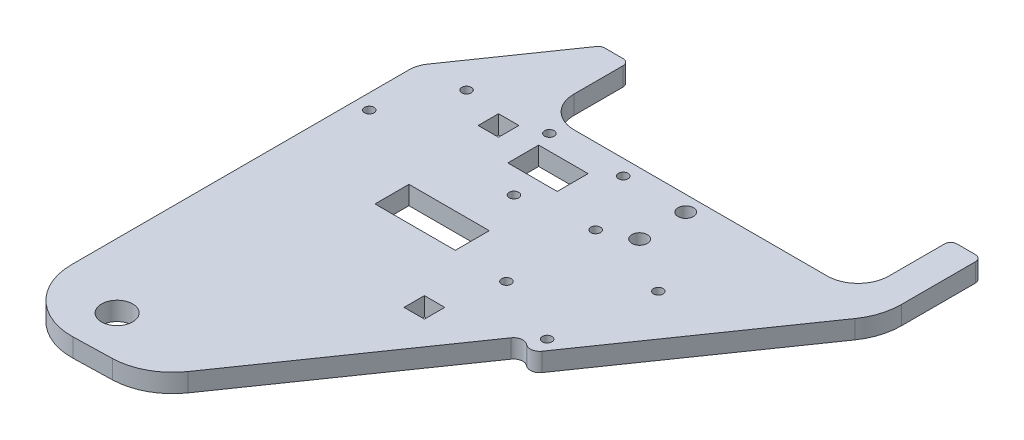
from build123d import *

# Parameters (mm, degrees)
DODANIE_WYCI_GNI_CIE1_DEPTH = 6
SZKIC3_R                    = 5.05
WYTNIJ_WYCI_GNI_CIE1_DEPTH  = 172.237795034
SZKIC5_R                    = 1.55
SZKIC5_W                    = 26
SZKIC5_H                    = 11
SZKIC5_W_2                  = 16
SZKIC5_H_2                  = 10
WYTNIJ_WYCI_GNI_CIE2_DEPTH  = 172.237795034
DODANIE_WYCI_GNI_CIE2_DEPTH = 6
SZKIC6_R                    = 1.55
WYTNIJ_WYCI_GNI_CIE3_DEPTH  = 172.237795034
DODANIE_WYCI_GNI_CIE3_DEPTH = 6
SZKIC9_R                    = 1.55
WYTNIJ_WYCI_GNI_CIE5_DEPTH  = 6
SZKIC11_R                   = 1.55
WYTNIJ_WYCI_GNI_CIE6_DEPTH  = 6
SZKIC15_R                   = 2.5
WYTNIJ_WYCI_GNI_CIE7_DEPTH  = 6
SZKIC8_R                    = 1.55
WYTNIJ_WYCI_GNI_CIE4_DEPTH  = 172.237795034
SZKIC20_W                   = 6.6
SZKIC20_H                   = 6.6
WYTNIJ_WYCI_GNI_CIE9_DEPTH  = 6
WYTNIJ_WYCI_GNI_CIE10_DEPTH = 10


with BuildPart() as part:
    # Szkic2 → Dodanie-wyciągnięcie1 (new body)
    with BuildSketch(Plane(origin=(0, 0, 0), x_dir=(1, 0, 0), z_dir=(0, 1, 0))):
        with BuildLine():
            Line((-2.705874152, 127.916025414), (-8.705874152, 127.916025414))
            ThreePointArc((-8.705874152, 127.916025414), (-10.120087715, 127.330238976), (-10.705874152, 125.916025414))
            Line((-10.705874152, 125.916025414), (-10.705874152, 88.696086508))
            ThreePointArc((-10.705874152, 88.696086508), (-11.877447027, 85.867659383), (-14.705874152, 84.696086508))
            Line((-14.705874152, 84.696086508), (-30.205874152, 84.696086508))
            ThreePointArc((-30.205874152, 84.696086508), (-33.034301277, 83.524513632), (-34.205874152, 80.696086508))
            Line((-34.205874152, 80.696086508), (-34.205874152, 69.929357434))
            Line((-34.205874152, 69.929357434), (-34.205874152, 68.036244156))
            Line((-34.205874152, 68.036244156), (-34.205874152, 10.604511111))
            Line((-34.205874152, 10.604511111), (-34.205874152, -19.154356935))
            ThreePointArc((-34.205874152, -19.154356935), (-21.880415638, -37.623287954), (-0.095732854, -33.328414665))
            Line((-0.095732854, -33.328414665), (14.157093559, -19.139859884))
            Line((14.157093559, -19.139859884), (55.027168237, 21.545915465))
            ThreePointArc((55.027168237, 21.545915465), (56.334805154, 23.495770338), (56.794125848, 25.798132784))
            Line((56.794125848, 25.798132784), (56.794125848, 30.935818421))
            Line((56.794125848, 30.935818421), (56.794125848, 59.333926751))
            ThreePointArc((56.794125848, 59.333926751), (64.677605901, 81.048439594), (85.935948442, 90.090131813))
            Line((85.935948442, 90.090131813), (91.371133341, 90.090131813))
            ThreePointArc((91.371133341, 90.090131813), (105.458816444, 95.925441216), (111.294125848, 110.013124319))
            Line((111.294125848, 110.013124319), (111.294125848, 128))
            ThreePointArc((111.294125848, 128), (110.70833941, 129.414213562), (109.294125848, 130))
            Line((109.294125848, 130), (103.294125848, 130))
            ThreePointArc((103.294125848, 130), (101.879912285, 129.414213562), (101.294125848, 128))
            Line((101.294125848, 128), (101.294125848, 110))
            ThreePointArc((101.294125848, 110), (98.36519366, 102.928932188), (91.294125848, 100))
            Line((91.294125848, 100), (9.294125848, 100))
            ThreePointArc((9.294125848, 100), (2.223058036, 102.928932188), (-0.705874152, 110))
            Line((-0.705874152, 110), (-0.705874152, 125.916025414))
            ThreePointArc((-0.705874152, 125.916025414), (-1.29166059, 127.330238976), (-2.705874152, 127.916025414))
        make_face()
    extrude(amount=DODANIE_WYCI_GNI_CIE1_DEPTH)

    # Szkic3 → Wytnij-wyciągnięcie1 (cut, through all)
    with BuildSketch(Plane(origin=(0, 6, 0), x_dir=(1, 0, 0), z_dir=(0, 1, 0))):
        with Locations(Location((-13.29618586, -25.303913492, 0), (0, 0, 270))):
            Circle(SZKIC3_R)
    extrude(amount=-WYTNIJ_WYCI_GNI_CIE1_DEPTH, mode=Mode.SUBTRACT)

    # Szkic5 → Wytnij-wyciągnięcie2 (cut, through all)
    with BuildSketch(Plane(origin=(0, 6, 0), x_dir=(1, 0, 0), z_dir=(0, 1, 0))):
        with Locations(Location((40.894125848, 75.45, 0), (0, 0, 270))):
            Circle(SZKIC5_R)
        with Locations(Location((30.260526652, 95, 0), (0, 0, 270))):
            Circle(SZKIC5_R)
        with Locations(Location((6.360542819, 95, 0), (0, 0, 270))):
            Circle(SZKIC5_R)
        with Locations(Location((40.894125848, 46.55, 0), (0, 0, 270))):
            Circle(SZKIC5_R)
        with Locations(Location((17.894125848, 72, 0), (0, 0, 270))):
            Circle(SZKIC5_R)
        with Locations((10.894125848, 52.5)):
            Rectangle(SZKIC5_W, SZKIC5_H)
        with Locations((15.894125848, 85)):
            Rectangle(SZKIC5_W_2, SZKIC5_H_2)
    extrude(amount=-WYTNIJ_WYCI_GNI_CIE2_DEPTH, mode=Mode.SUBTRACT)

    # Szkic12 → Dodanie-wyciągnięcie2 (add)
    with BuildSketch(Plane.XZ):
        with BuildLine():
            Line((28.406352316, 21.766792401), (22.674893132, 30.029606522))
            ThreePointArc((22.674893132, 30.029606522), (15.741620567, 36.230120828), (6.753517107, 38.623996834))
            Line((6.753517107, 38.623996834), (-1.505533921, 38.835570804))
            Line((-1.505533921, 38.835570804), (-13.693695858, 39.147797694))
            Line((-13.693695858, 39.147797694), (55.027168237, -21.545915465))
            ThreePointArc((55.027168237, -21.545915465), (56.334805154, -23.495770338), (56.794125848, -25.798132784))
            Line((56.794125848, -25.798132784), (56.794125848, -59.333926751))
            ThreePointArc((56.794125848, -59.333926751), (64.677605901, -81.048439594), (85.935948442, -90.090131813))
            Line((85.935948442, -90.090131813), (91.371133341, -90.090131813))
            Line((91.371133341, -90.090131813), (111.294125848, -110.013124319))
            Line((111.294125848, -110.013124319), (111.294125848, -103.986622655))
            ThreePointArc((111.294125848, -103.986622655), (110.381700995, -98.014648527), (107.72767835, -92.58757216))
            Line((107.72767835, -92.58757216), (89.166132072, -65.828137643))
            Line((89.166132072, -65.828137643), (62.775344571, -27.781601032))
            Line((62.775344571, -27.781601032), (28.406352316, 21.766792401))
        make_face()
    extrude(amount=-DODANIE_WYCI_GNI_CIE2_DEPTH)

    # Szkic6 → Wytnij-wyciągnięcie3 (cut, through all)
    with BuildSketch(Plane.XZ):
        with Locations(Location((68.241593591, -68.382704099, 0), (0, 0, 270))):
            Circle(SZKIC6_R)
    extrude(amount=-WYTNIJ_WYCI_GNI_CIE3_DEPTH, mode=Mode.SUBTRACT)

    # Szkic13 → Dodanie-wyciągnięcie3 (add)
    with BuildSketch(Plane.XZ):
        with BuildLine():
            Line((-34.205874152, -80.696086508), (-34.205874152, -90.183506419))
            ThreePointArc((-34.205874152, -90.183506419), (-33.840904211, -92.57229607), (-32.779295153, -94.743126617))
            Line((-32.779295153, -94.743126617), (-10.365682355, -127.055930463))
            ThreePointArc((-10.365682355, -127.055930463), (-9.649740147, -127.688003136), (-8.722327105, -127.916025414))
            Line((-8.722327105, -127.916025414), (-6.264571206, -127.916025414))
            Line((-6.264571206, -127.916025414), (-6.264571206, -80.696086508))
            Line((-6.264571206, -80.696086508), (-8.705874152, -80.696086508))
            Line((-8.705874152, -80.696086508), (-34.205874152, -80.696086508))
        make_face()
    extrude(amount=-DODANIE_WYCI_GNI_CIE3_DEPTH)

    # Szkic9 → Wytnij-wyciągnięcie5 (cut)
    with BuildSketch(Plane.XZ):
        with Locations(Location((63.668699873, -36.96490988, 0), (0, 0, 270))):
            Circle(SZKIC9_R)
    extrude(amount=-WYTNIJ_WYCI_GNI_CIE5_DEPTH, mode=Mode.SUBTRACT)

    # Szkic11 → Wytnij-wyciągnięcie6 (cut)
    with BuildSketch(Plane.XZ):
        with Locations(Location((-29.337186675, -72.387878859, 0), (0, 0, 270))):
            Circle(SZKIC11_R)
    extrude(amount=-WYTNIJ_WYCI_GNI_CIE6_DEPTH, mode=Mode.SUBTRACT)

    # Szkic15 → Wytnij-wyciągnięcie7 (cut)
    with BuildSketch(Plane.XZ):
        with Locations(Location((50.565790386, -80.001305928, 0), (0, 0, 270))):
            Circle(SZKIC15_R)
        with Locations(Location((50.484519469, -95.001085761, 0), (0, 0, 270))):
            Circle(SZKIC15_R)
    extrude(amount=-WYTNIJ_WYCI_GNI_CIE7_DEPTH, mode=Mode.SUBTRACT)

    # Szkic8 → Wytnij-wyciągnięcie4 (cut, through all)
    with BuildSketch(Plane.XZ):
        with Locations(Location((-19.205874152, -93.746086504, 0), (0, 0, 270))):
            Circle(SZKIC8_R)
    extrude(amount=-WYTNIJ_WYCI_GNI_CIE4_DEPTH, mode=Mode.SUBTRACT)

    # Szkic20 → Wytnij-wyciągnięcie9 (cut)
    with BuildSketch(Plane.XZ):
        with Locations((34.894125848, -26)):
            Rectangle(SZKIC20_W, SZKIC20_H)
        with Locations((-4.105874152, -89)):
            Rectangle(SZKIC20_W, SZKIC20_H)
    extrude(amount=-WYTNIJ_WYCI_GNI_CIE9_DEPTH, mode=Mode.SUBTRACT)

    # Szkic21 → Wytnij-wyciągnięcie10 (cut)
    with BuildSketch(Plane.XZ):
        with BuildLine():
            Line((62.051453687, -32.001592967), (61.640614874, -32.286569229))
            ThreePointArc((61.640614874, -32.286569229), (59.396767724, -32.773629702), (57.465724425, -31.531393928))
            Line((57.465724425, -31.531393928), (14.621138886, 30.235921359))
            ThreePointArc((14.621138886, 30.235921359), (7.68786632, 36.436435664), (-1.300237139, 38.830311671))
            Line((-1.300237139, 38.830311671), (6.753517107, 38.623996834))
            ThreePointArc((6.753517107, 38.623996834), (15.741620567, 36.230120828), (22.674893132, 30.029606522))
            Line((22.674893132, 30.029606522), (66.226344136, -32.756768268))
            ThreePointArc((66.226344136, -32.756768268), (64.295300837, -31.514532495), (62.051453687, -32.001592967))
        make_face()
    extrude(amount=-WYTNIJ_WYCI_GNI_CIE10_DEPTH, mode=Mode.SUBTRACT)


solid = part.part
